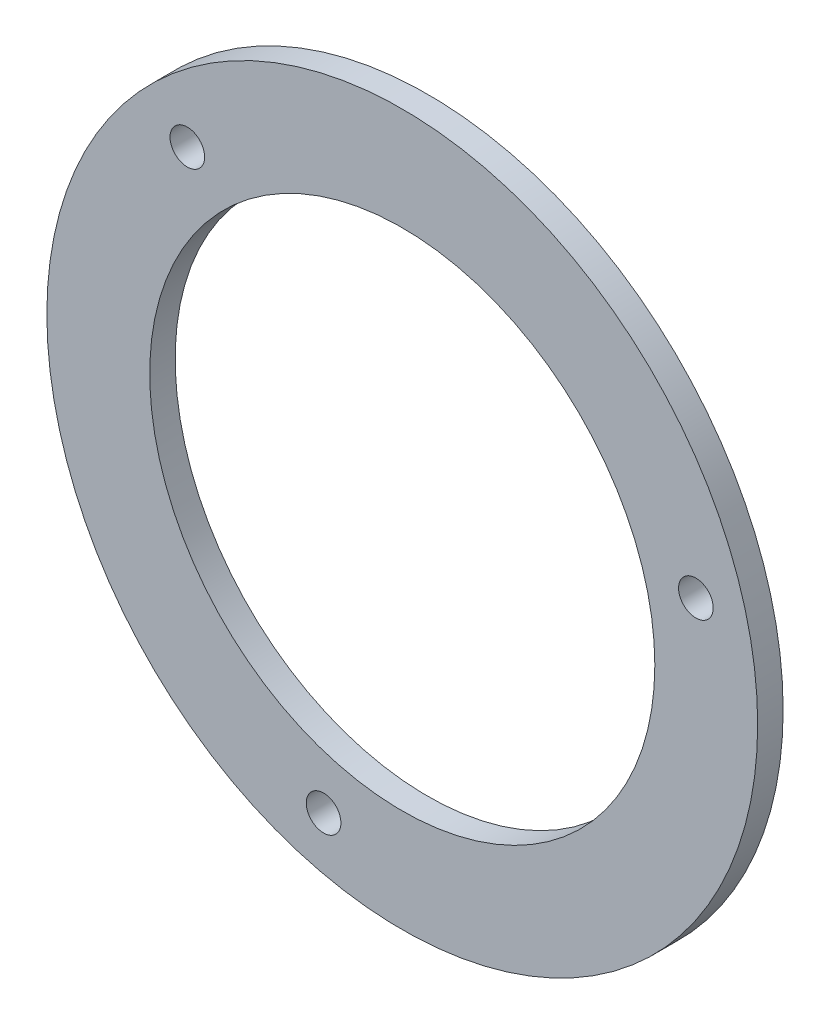
from build123d import *

# Parameters (mm, degrees)
S01_TPU_BEAD_AND_BEARING_OUTER_RACE_KE_R       = 34.9
S01_TPU_BEAD_AND_BEARING_OUTER_RACE_KE_R_2     = 24.8
F_01_TPU_BEAD_AND_BEARING_OUTER_RACE_KEE_DEPTH = 2.5
F_02_START                                     = -0.1
S02_FLANGE_SCREW_CLEARANCE_R                   = 1.7
F_02_FLANGE_SCREW_CLEARANCE_DEPTH              = 2.7


with BuildPart() as part:
    # S01 - TPU bead and bearing outer-race keeper → 01 - TPU bead and bearing outer-race keeper (new body)
    with BuildSketch(Plane.XY):
        Circle(S01_TPU_BEAD_AND_BEARING_OUTER_RACE_KE_R)
        Circle(S01_TPU_BEAD_AND_BEARING_OUTER_RACE_KE_R_2, mode=Mode.SUBTRACT)
    extrude(amount=F_01_TPU_BEAD_AND_BEARING_OUTER_RACE_KEE_DEPTH)

    # S02 - Flange screw clearance → 02 - Flange screw clearance (cut)
    with BuildSketch(Plane.XY.offset(F_02_START)):
        with Locations(Location((28.832885915, 7.725748496, 0), (0, 0, 180))):
            Circle(S02_FLANGE_SCREW_CLEARANCE_R)
        with Locations(Location((-21.107137418, 21.107137418, 0), (0, 0, 180))):
            Circle(S02_FLANGE_SCREW_CLEARANCE_R)
        with Locations(Location((-7.725748496, -28.832885915, 0), (0, 0, 180))):
            Circle(S02_FLANGE_SCREW_CLEARANCE_R)
    extrude(amount=F_02_FLANGE_SCREW_CLEARANCE_DEPTH, mode=Mode.SUBTRACT)


solid = part.part
